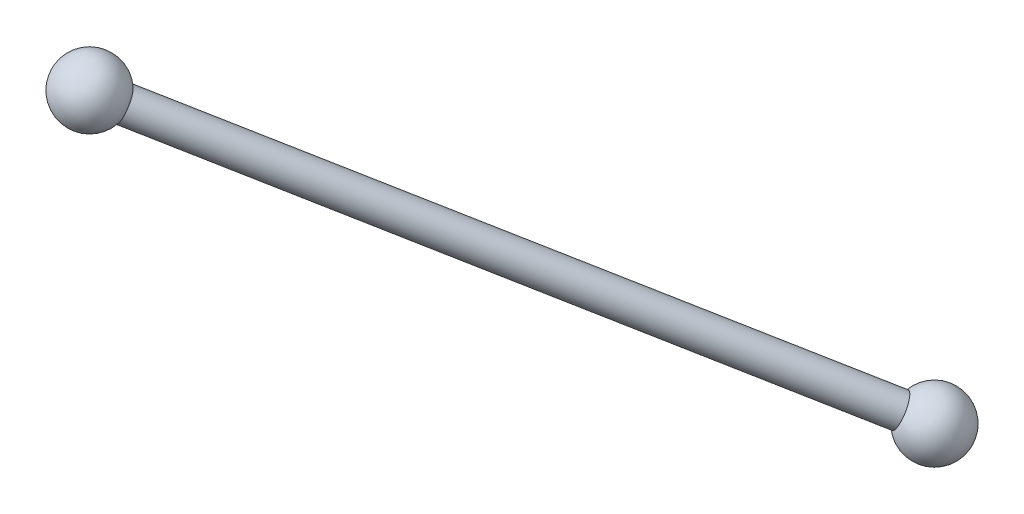
from build123d import *

# Parameters (mm, degrees)
STRAIGHT_STRUT_CORE_SKETCH_R = 1.5
STRAIGHT_STRUT_CORE_DEPTH    = 64.364941753


with BuildPart() as part:
    # Straight strut core sketch → Straight strut core (new body)
    with BuildSketch(Plane(origin=(-19.213082616, 13.127289135, 19.213082616), x_dir=(-0.7711166905176088, -0.35918583184116987, -0.5257038974648537), z_dir=(0.6366938429144502, -0.43501942576095104, -0.6366938429146632))):
        with Locations(Location((67.536559993, -74.931313845, 0), (0, 0, 23.509976133))):
            Circle(STRAIGHT_STRUT_CORE_SKETCH_R)
    extrude(amount=STRAIGHT_STRUT_CORE_DEPTH)

    # Ball end1 profile → Ball end1 (revolve)
    with BuildSketch(Plane(origin=(0, -73, 0), x_dir=(-1, 0, 0), z_dir=(0, -1, 0))):
        with BuildLine():
            Line((71.291651246, -28.980762114), (71.291651246, -22.980762114))
            ThreePointArc((71.291651246, -22.980762114), (68.291651246, -25.980762114), (71.291651246, -28.980762114))
        make_face()
    revolve(axis=Axis((-71.291651246, -73, 15.980762114), (0, 0, 1)))

    # Ball end2 profile → Ball end2 (revolve)
    with BuildSketch(Plane(origin=(0, -101, 0), x_dir=(-1, 0, 0), z_dir=(0, -1, 0))):
        with BuildLine():
            Line((30.310889133, 12), (30.310889133, 18))
            ThreePointArc((30.310889133, 18), (27.310889133, 15), (30.310889133, 12))
        make_face()
    revolve(axis=Axis((-30.310889133, -101, -25), (0, 0, 1)))


solid = part.part
